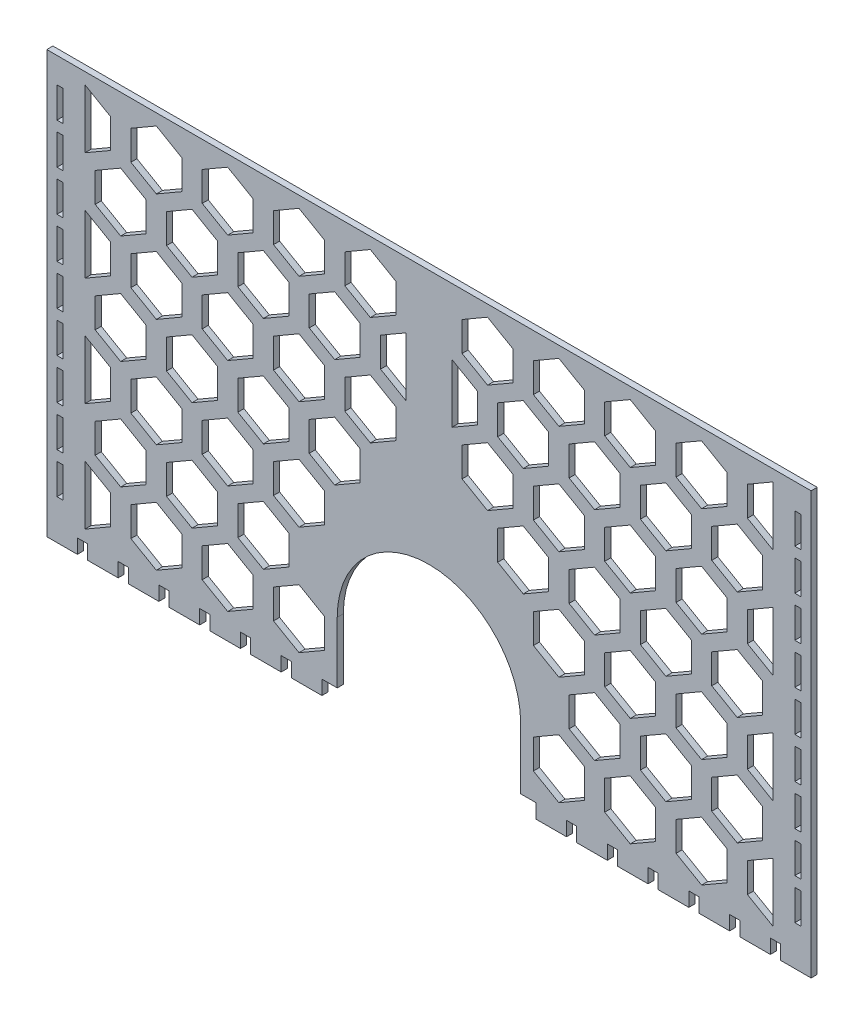
from build123d import *

# Parameters (mm, degrees)
SKETCH1_W           = 3
SKETCH1_H           = 15
BOSS_EXTRUDE1_DEPTH = 3
SKETCH7_W           = 15
SKETCH7_H           = 3
BOSS_EXTRUDE2_DEPTH = 7
SKETCH8_W           = 15
SKETCH8_H           = 3
BOSS_EXTRUDE3_DEPTH = 7
CUT_EXTRUDE1_DEPTH  = 216.903334852


with BuildPart() as part:
    # Sketch1 → Boss-Extrude1 (new body)
    with BuildSketch(Plane.XY):
        with BuildLine():
            Line((-187.5, 100), (-187.5, -100))
            Line((-187.5, -100), (-45, -100))
            Line((-45, -100), (-45, -70))
            ThreePointArc((-45, -70), (0, -25), (45, -70))
            Line((45, -70), (45, -100))
            Line((45, -100), (187.5, -100))
            Line((187.5, -100), (187.5, 100))
            Line((187.5, 100), (-187.5, 100))
        make_face()
        with Locations((-181, -80)):
            Rectangle(SKETCH1_W, SKETCH1_H, mode=Mode.SUBTRACT)
        with Locations((-181, -60)):
            Rectangle(SKETCH1_W, SKETCH1_H, mode=Mode.SUBTRACT)
        with Locations((-181, -40)):
            Rectangle(SKETCH1_W, SKETCH1_H, mode=Mode.SUBTRACT)
        with Locations((-181, -20)):
            Rectangle(SKETCH1_W, SKETCH1_H, mode=Mode.SUBTRACT)
        with Locations((-181, 0)):
            Rectangle(SKETCH1_W, SKETCH1_H, mode=Mode.SUBTRACT)
        with Locations((181, -80)):
            Rectangle(SKETCH1_W, SKETCH1_H, mode=Mode.SUBTRACT)
        with Locations((181, -60)):
            Rectangle(SKETCH1_W, SKETCH1_H, mode=Mode.SUBTRACT)
        with Locations((181, -40)):
            Rectangle(SKETCH1_W, SKETCH1_H, mode=Mode.SUBTRACT)
        with Locations((181, -20)):
            Rectangle(SKETCH1_W, SKETCH1_H, mode=Mode.SUBTRACT)
        with Locations((-181, 20)):
            Rectangle(SKETCH1_W, SKETCH1_H, mode=Mode.SUBTRACT)
        with Locations((-181, 40)):
            Rectangle(SKETCH1_W, SKETCH1_H, mode=Mode.SUBTRACT)
        with Locations((-181, 60)):
            Rectangle(SKETCH1_W, SKETCH1_H, mode=Mode.SUBTRACT)
        with Locations((-181, 80)):
            Rectangle(SKETCH1_W, SKETCH1_H, mode=Mode.SUBTRACT)
        with Locations((181, 0)):
            Rectangle(SKETCH1_W, SKETCH1_H, mode=Mode.SUBTRACT)
        with Locations((181, 20)):
            Rectangle(SKETCH1_W, SKETCH1_H, mode=Mode.SUBTRACT)
        with Locations((181, 40)):
            Rectangle(SKETCH1_W, SKETCH1_H, mode=Mode.SUBTRACT)
        with Locations((181, 60)):
            Rectangle(SKETCH1_W, SKETCH1_H, mode=Mode.SUBTRACT)
        with Locations((181, 80)):
            Rectangle(SKETCH1_W, SKETCH1_H, mode=Mode.SUBTRACT)
    extrude(amount=BOSS_EXTRUDE1_DEPTH)

    # Sketch7 → Boss-Extrude2 (add)
    with BuildSketch(Plane.XZ.offset(100)):
        with Locations((-180, 1.5)):
            Rectangle(SKETCH7_W, SKETCH7_H)
        with Locations((-160, 1.5)):
            Rectangle(SKETCH7_W, SKETCH7_H)
        with Locations((-140, 1.5)):
            Rectangle(SKETCH7_W, SKETCH7_H)
        with Locations((-120, 1.5)):
            Rectangle(SKETCH7_W, SKETCH7_H)
        with Locations((-100, 1.5)):
            Rectangle(SKETCH7_W, SKETCH7_H)
        with Locations((-80, 1.5)):
            Rectangle(SKETCH7_W, SKETCH7_H)
        with Locations((-60, 1.5)):
            Rectangle(SKETCH7_W, SKETCH7_H)
    extrude(amount=BOSS_EXTRUDE2_DEPTH)

    # Sketch8 → Boss-Extrude3 (add)
    with BuildSketch(Plane.XZ.offset(100)):
        with Locations((180, 1.5)):
            Rectangle(SKETCH8_W, SKETCH8_H)
        with Locations((160, 1.5)):
            Rectangle(SKETCH8_W, SKETCH8_H)
        with Locations((140, 1.5)):
            Rectangle(SKETCH8_W, SKETCH8_H)
        with Locations((120, 1.5)):
            Rectangle(SKETCH8_W, SKETCH8_H)
        with Locations((100, 1.5)):
            Rectangle(SKETCH8_W, SKETCH8_H)
        with Locations((80, 1.5)):
            Rectangle(SKETCH8_W, SKETCH8_H)
        with Locations((60, 1.5)):
            Rectangle(SKETCH8_W, SKETCH8_H)
    extrude(amount=BOSS_EXTRUDE3_DEPTH)

    # Sketch10 → Cut-Extrude1 (cut, through all)
    with BuildSketch(Plane(origin=(0, 0, 0), x_dir=(-1, 0, 0), z_dir=(0, 0, -1))):
        Polygon((-116.25, -14.43375673), (-103.75, -7.216878365), (-103.75, 7.216878365), (-116.25, 14.43375673), (-128.75, 7.216878365), (-128.75, -7.216878365), align=None)
        Polygon((-98.75, -12.216878365), (-111.25, -19.43375673), (-111.25, -33.867513459), (-98.75, -41.084391824), (-86.25, -33.867513459), (-86.25, -19.43375673), align=None)
        Polygon((-133.75, -41.084391824), (-121.25, -33.867513459), (-121.25, -19.43375673), (-133.75, -12.216878365), (-146.25, -19.43375673), (-146.25, -33.867513459), align=None)
        Polygon((-116.25, -67.735026919), (-103.75, -60.518148554), (-103.75, -46.084391824), (-116.25, -38.867513459), (-128.75, -46.084391824), (-128.75, -60.518148554), align=None)
        Polygon((-81.25, -14.43375673), (-68.75, -7.216878365), (-68.75, 7.216878365), (-81.25, 14.43375673), (-93.75, 7.216878365), (-93.75, -7.216878365), align=None)
        Polygon((-81.25, -67.735026919), (-68.75, -60.518148554), (-68.75, -46.084391824), (-81.25, -38.867513459), (-93.75, -46.084391824), (-93.75, -60.518148554), align=None)
        Polygon((-63.75, -41.084391824), (-51.25, -33.867513459), (-51.25, -19.43375673), (-63.75, -12.216878365), (-76.25, -19.43375673), (-76.25, -33.867513459), align=None)
        Polygon((-151.25, -14.43375673), (-138.75, -7.216878365), (-138.75, 7.216878365), (-151.25, 14.43375673), (-163.75, 7.216878365), (-163.75, -7.216878365), align=None)
        Polygon((-151.25, -67.735026919), (-138.75, -60.518148554), (-138.75, -46.084391824), (-151.25, -38.867513459), (-163.75, -46.084391824), (-163.75, -60.518148554), align=None)
        Polygon((-168.75, -41.084391824), (-156.25, -33.867513459), (-156.25, -19.43375673), (-168.75, -12.216878365), align=None)
        Polygon((-133.75, 12.216878365), (-121.25, 19.43375673), (-121.25, 33.867513459), (-133.75, 41.084391824), (-146.25, 33.867513459), (-146.25, 19.43375673), align=None)
        Polygon((-98.75, 12.216878365), (-86.25, 19.43375673), (-86.25, 33.867513459), (-98.75, 41.084391824), (-111.25, 33.867513459), (-111.25, 19.43375673), align=None)
        Polygon((-168.75, 12.216878365), (-156.25, 19.43375673), (-156.25, 33.867513459), (-168.75, 41.084391824), align=None)
        Polygon((-63.75, 12.216878365), (-51.25, 19.43375673), (-51.25, 33.867513459), (-63.75, 41.084391824), (-76.25, 33.867513459), (-76.25, 19.43375673), align=None)
        Polygon((-28.75, 12.216878365), (-16.25, 19.43375673), (-16.25, 33.867513459), (-28.75, 41.084391824), (-41.25, 33.867513459), (-41.25, 19.43375673), align=None)
        Polygon((-46.25, -14.43375673), (-33.75, -7.216878365), (-33.75, 7.216878365), (-46.25, 14.43375673), (-58.75, 7.216878365), (-58.75, -7.216878365), align=None)
        Polygon((-133.75, -94.385662014), (-121.25, -87.168783649), (-121.25, -72.735026919), (-133.75, -65.518148554), (-146.25, -72.735026919), (-146.25, -87.168783649), align=None)
        Polygon((-98.75, -94.385662014), (-86.25, -87.168783649), (-86.25, -72.735026919), (-98.75, -65.518148554), (-111.25, -72.735026919), (-111.25, -87.168783649), align=None)
        Polygon((-63.75, -94.385662014), (-51.25, -87.168783649), (-51.25, -72.735026919), (-63.75, -65.518148554), (-76.25, -72.735026919), (-76.25, -87.168783649), align=None)
        Polygon((-168.75, -94.385662014), (-156.25, -87.168783649), (-156.25, -72.735026919), (-168.75, -65.518148554), align=None)
        Polygon((-151.25, 38.867513459), (-138.75, 46.084391824), (-138.75, 60.518148554), (-151.25, 67.735026919), (-163.75, 60.518148554), (-163.75, 46.084391824), align=None)
        Polygon((-116.25, 38.867513459), (-103.75, 46.084391824), (-103.75, 60.518148554), (-116.25, 67.735026919), (-128.75, 60.518148554), (-128.75, 46.084391824), align=None)
        Polygon((-81.25, 38.867513459), (-68.75, 46.084391824), (-68.75, 60.518148554), (-81.25, 67.735026919), (-93.75, 60.518148554), (-93.75, 46.084391824), align=None)
        Polygon((-46.25, 38.867513459), (-33.75, 46.084391824), (-33.75, 60.518148554), (-46.25, 67.735026919), (-58.75, 60.518148554), (-58.75, 46.084391824), align=None)
        Polygon((-11.25, 67.735026919), (-23.75, 60.518148554), (-23.75, 46.084391824), (-11.25, 38.867513459), align=None)
        Polygon((-133.75, 65.518148554), (-121.25, 72.735026919), (-121.25, 87.168783649), (-133.75, 94.385662014), (-146.25, 87.168783649), (-146.25, 72.735026919), align=None)
        Polygon((-98.75, 65.518148554), (-86.25, 72.735026919), (-86.25, 87.168783649), (-98.75, 94.385662014), (-111.25, 87.168783649), (-111.25, 72.735026919), align=None)
        Polygon((-168.75, 65.518148554), (-156.25, 72.735026919), (-156.25, 87.168783649), (-168.75, 94.385662014), align=None)
        Polygon((-63.75, 65.518148554), (-51.25, 72.735026919), (-51.25, 87.168783649), (-63.75, 94.385662014), (-76.25, 87.168783649), (-76.25, 72.735026919), align=None)
        Polygon((-28.75, 65.518148554), (-16.25, 72.735026919), (-16.25, 87.168783649), (-28.75, 94.385662014), (-41.25, 87.168783649), (-41.25, 72.735026919), align=None)
        Polygon((41.25, 72.735026919), (28.75, 65.518148554), (16.25, 72.735026919), (16.25, 87.168783649), (28.75, 94.385662014), (41.25, 87.168783649), align=None)
        Polygon((76.25, 72.735026919), (63.75, 65.518148554), (51.25, 72.735026919), (51.25, 87.168783649), (63.75, 94.385662014), (76.25, 87.168783649), align=None)
        Polygon((168.75, 94.385662014), (168.75, 65.518148554), (156.25, 72.735026919), (156.25, 87.168783649), align=None)
        Polygon((111.25, 72.735026919), (98.75, 65.518148554), (86.25, 72.735026919), (86.25, 87.168783649), (98.75, 94.385662014), (111.25, 87.168783649), align=None)
        Polygon((146.25, 72.735026919), (133.75, 65.518148554), (121.25, 72.735026919), (121.25, 87.168783649), (133.75, 94.385662014), (146.25, 87.168783649), align=None)
        Polygon((11.25, 67.735026919), (11.25, 38.867513459), (23.75, 46.084391824), (23.75, 60.518148554), align=None)
        Polygon((58.75, 46.084391824), (46.25, 38.867513459), (33.75, 46.084391824), (33.75, 60.518148554), (46.25, 67.735026919), (58.75, 60.518148554), align=None)
        Polygon((93.75, 46.084391824), (81.25, 38.867513459), (68.75, 46.084391824), (68.75, 60.518148554), (81.25, 67.735026919), (93.75, 60.518148554), align=None)
        Polygon((128.75, 46.084391824), (116.25, 38.867513459), (103.75, 46.084391824), (103.75, 60.518148554), (116.25, 67.735026919), (128.75, 60.518148554), align=None)
        Polygon((163.75, 46.084391824), (151.25, 38.867513459), (138.75, 46.084391824), (138.75, 60.518148554), (151.25, 67.735026919), (163.75, 60.518148554), align=None)
        Polygon((168.75, -65.518148554), (168.75, -94.385662014), (156.25, -87.168783649), (156.25, -72.735026919), align=None)
        Polygon((76.25, -87.168783649), (63.75, -94.385662014), (51.25, -87.168783649), (51.25, -72.735026919), (63.75, -65.518148554), (76.25, -72.735026919), align=None)
        Polygon((111.25, -87.168783649), (98.75, -94.385662014), (86.25, -87.168783649), (86.25, -72.735026919), (98.75, -65.518148554), (111.25, -72.735026919), align=None)
        Polygon((146.25, -87.168783649), (133.75, -94.385662014), (121.25, -87.168783649), (121.25, -72.735026919), (133.75, -65.518148554), (146.25, -72.735026919), align=None)
        Polygon((58.75, -7.216878365), (46.25, -14.43375673), (33.75, -7.216878365), (33.75, 7.216878365), (46.25, 14.43375673), (58.75, 7.216878365), align=None)
        Polygon((41.25, 19.43375673), (28.75, 12.216878365), (16.25, 19.43375673), (16.25, 33.867513459), (28.75, 41.084391824), (41.25, 33.867513459), align=None)
        Polygon((76.25, 19.43375673), (63.75, 12.216878365), (51.25, 19.43375673), (51.25, 33.867513459), (63.75, 41.084391824), (76.25, 33.867513459), align=None)
        Polygon((168.75, 41.084391824), (168.75, 12.216878365), (156.25, 19.43375673), (156.25, 33.867513459), align=None)
        Polygon((111.25, 19.43375673), (98.75, 12.216878365), (86.25, 19.43375673), (86.25, 33.867513459), (98.75, 41.084391824), (111.25, 33.867513459), align=None)
        Polygon((146.25, 19.43375673), (133.75, 12.216878365), (121.25, 19.43375673), (121.25, 33.867513459), (133.75, 41.084391824), (146.25, 33.867513459), align=None)
        Polygon((168.75, -12.216878365), (168.75, -41.084391824), (156.25, -33.867513459), (156.25, -19.43375673), align=None)
        Polygon((163.75, -60.518148554), (151.25, -67.735026919), (138.75, -60.518148554), (138.75, -46.084391824), (151.25, -38.867513459), (163.75, -46.084391824), align=None)
        Polygon((163.75, -7.216878365), (151.25, -14.43375673), (138.75, -7.216878365), (138.75, 7.216878365), (151.25, 14.43375673), (163.75, 7.216878365), align=None)
        Polygon((76.25, -33.867513459), (63.75, -41.084391824), (51.25, -33.867513459), (51.25, -19.43375673), (63.75, -12.216878365), (76.25, -19.43375673), align=None)
        Polygon((93.75, -60.518148554), (81.25, -67.735026919), (68.75, -60.518148554), (68.75, -46.084391824), (81.25, -38.867513459), (93.75, -46.084391824), align=None)
        Polygon((93.75, -7.216878365), (81.25, -14.43375673), (68.75, -7.216878365), (68.75, 7.216878365), (81.25, 14.43375673), (93.75, 7.216878365), align=None)
        Polygon((128.75, -60.518148554), (116.25, -67.735026919), (103.75, -60.518148554), (103.75, -46.084391824), (116.25, -38.867513459), (128.75, -46.084391824), align=None)
        Polygon((146.25, -33.867513459), (133.75, -41.084391824), (121.25, -33.867513459), (121.25, -19.43375673), (133.75, -12.216878365), (146.25, -19.43375673), align=None)
        Polygon((86.25, -19.43375673), (98.75, -12.216878365), (111.25, -19.43375673), (111.25, -33.867513459), (98.75, -41.084391824), (86.25, -33.867513459), align=None)
        Polygon((128.75, -7.216878365), (116.25, -14.43375673), (103.75, -7.216878365), (103.75, 7.216878365), (116.25, 14.43375673), (128.75, 7.216878365), align=None)
    extrude(amount=-CUT_EXTRUDE1_DEPTH, mode=Mode.SUBTRACT)


solid = part.part
